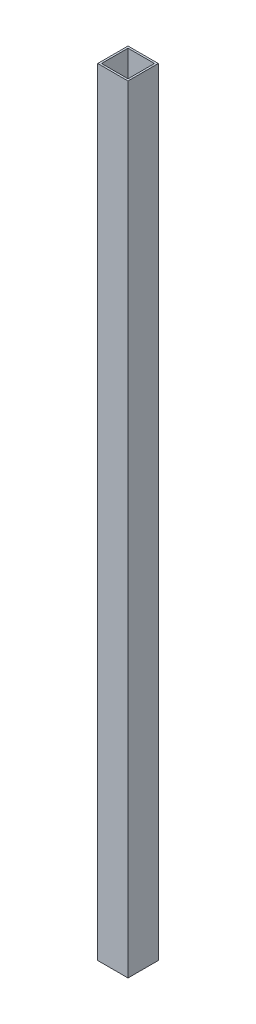
from build123d import *

# Parameters (mm, degrees)
SKETCH1_W           = 50.8
SKETCH1_H           = 50.8
SKETCH1_W_2         = 44.45
SKETCH1_H_2         = 44.45
BOSS_EXTRUDE1_DEPTH = 1303.57


with BuildPart() as part:
    # Sketch1 → Boss-Extrude1 (new body)
    with BuildSketch(Plane(origin=(0, 0, 0), x_dir=(1, 0, 0), z_dir=(0, 1, 0))):
        Rectangle(SKETCH1_W, SKETCH1_H)
        Rectangle(SKETCH1_W_2, SKETCH1_H_2, mode=Mode.SUBTRACT)
    extrude(amount=BOSS_EXTRUDE1_DEPTH)


solid = part.part
